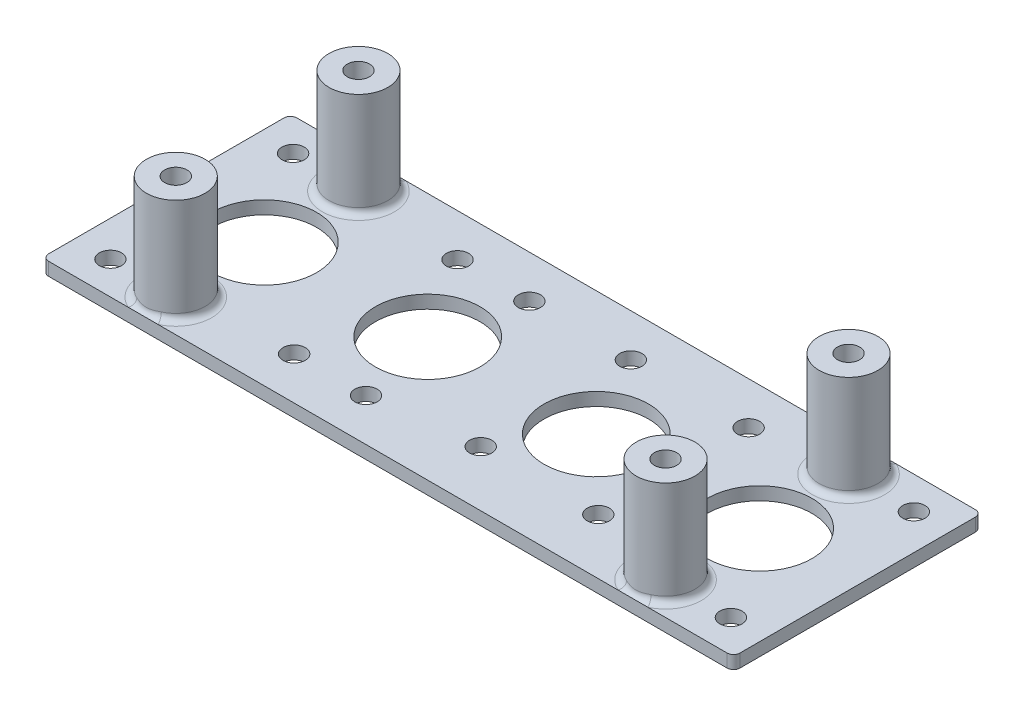
from build123d import *

# Parameters (mm, degrees)
SKETCH1_W           = 105.8
SKETCH1_H           = 37.999959088
SKETCH1_R           = 1.7
SKETCH1_R_2         = 8
BOSS_EXTRUDE3_DEPTH = 2
FILLET1_R           = 1
SKETCH4_R           = 4.5
SKETCH4_R_2         = 1.7
BOSS_EXTRUDE4_DEPTH = 16
FILLET2_R           = 1
CUT_EXTRUDE1_DEPTH  = 2


with BuildPart() as part:
    # Sketch1 → Boss-Extrude3 (new body)
    with BuildSketch(Plane(origin=(0, 0, 0), x_dir=(1, 0, 0), z_dir=(0, 1, 0))):
        with Locations((0, -2.0456e-05)):
            Rectangle(SKETCH1_W, SKETCH1_H)
        with Locations(Location((-47.5, 13.999959088, 0), (0, 0, 270))):
            Circle(SKETCH1_R, mode=Mode.SUBTRACT)
        with Locations(Location((-47.45213511, -14, 0), (0, 0, 270))):
            Circle(SKETCH1_R, mode=Mode.SUBTRACT)
        with Locations(Location((47.5, 13.999959088, 0), (0, 0, 270))):
            Circle(SKETCH1_R, mode=Mode.SUBTRACT)
        with Locations(Location((47.5, -14.000040912, 0), (0, 0, 270))):
            Circle(SKETCH1_R, mode=Mode.SUBTRACT)
        with Locations(Location((-20.838777713, 12.499959088, 0), (0, 0, 270))):
            Circle(SKETCH1_R, mode=Mode.SUBTRACT)
        with Locations(Location((-20.838777713, -12.500040912, 0), (0, 0, 270))):
            Circle(SKETCH1_R, mode=Mode.SUBTRACT)
        with Locations(Location((-9.838777713, 12.499959088, 0), (0, 0, 270))):
            Circle(SKETCH1_R, mode=Mode.SUBTRACT)
        with Locations(Location((-9.838777713, -12.500040912, 0), (0, 0, 270))):
            Circle(SKETCH1_R, mode=Mode.SUBTRACT)
        with Locations(Location((5.708304913, 12.482293054, 0), (0, 0, 270))):
            Circle(SKETCH1_R, mode=Mode.SUBTRACT)
        with Locations(Location((5.708304913, -10.500040912, 0), (0, 0, 270))):
            Circle(SKETCH1_R, mode=Mode.SUBTRACT)
        with Locations(Location((23.708296244, 12.499959088, 0), (0, 0, 270))):
            Circle(SKETCH1_R, mode=Mode.SUBTRACT)
        with Locations(Location((23.708296244, -10.500040912, 0), (0, 0, 270))):
            Circle(SKETCH1_R, mode=Mode.SUBTRACT)
        with Locations(Location((-37.5, 13.999959088, 0), (0, 0, 270))):
            Circle(SKETCH1_R, mode=Mode.SUBTRACT)
        with Locations(Location((-37.45213511, -14, 0), (0, 0, 270))):
            Circle(SKETCH1_R, mode=Mode.SUBTRACT)
        with Locations(Location((37.5, 13.999959088, 0), (0, 0, 270))):
            Circle(SKETCH1_R, mode=Mode.SUBTRACT)
        with Locations(Location((37.5, -14.000040912, 0), (0, 0, 270))):
            Circle(SKETCH1_R, mode=Mode.SUBTRACT)
        with Locations(Location((-37.9, 0, 0), (0, 0, 270))):
            Circle(SKETCH1_R_2, mode=Mode.SUBTRACT)
        with Locations(Location((-12.9, 0, 0), (0, 0, 270))):
            Circle(SKETCH1_R_2, mode=Mode.SUBTRACT)
        with Locations(Location((37.9, 0, 0), (0, 0, 270))):
            Circle(SKETCH1_R_2, mode=Mode.SUBTRACT)
        with Locations(Location((12.9, 0, 0), (0, 0, 270))):
            Circle(SKETCH1_R_2, mode=Mode.SUBTRACT)
    extrude(amount=BOSS_EXTRUDE3_DEPTH)

    # Fillet1
    fillet1_edges = [part.edges().sort_by_distance(p)[0] for p in [
        (-52.9, 1, -18.999959088),
        (52.9, 1, -18.999959088),
        (52.9, 1, 19),
        (-52.9, 1, 19),
    ]]
    fillet(fillet1_edges, radius=FILLET1_R)

    # Sketch4 → Boss-Extrude4 (add)
    # profile 1 of 4: a face of its own
    with BuildSketch(Plane(origin=(0, 2, 0), x_dir=(1, 0, 0), z_dir=(0, 1, 0))):
        with Locations(Location((-37.5, 13.999959088, 0), (0, 0, 270))):
            Circle(SKETCH4_R)
        with Locations(Location((-37.5, 13.999959088, 0), (0, 0, 270))):
            Circle(SKETCH4_R_2, mode=Mode.SUBTRACT)
    # profile 2 of 4: a face of its own
    with BuildSketch(Plane(origin=(0, 2, 0), x_dir=(1, 0, 0), z_dir=(0, 1, 0))):
        with Locations(Location((-37.45213511, -14, 0), (0, 0, 270))):
            Circle(SKETCH4_R)
        with Locations(Location((-37.45213511, -14, 0), (0, 0, 270))):
            Circle(SKETCH4_R_2, mode=Mode.SUBTRACT)
    # profile 3 of 4: a face of its own
    with BuildSketch(Plane(origin=(0, 2, 0), x_dir=(1, 0, 0), z_dir=(0, 1, 0))):
        with Locations(Location((37.5, 13.999959088, 0), (0, 0, 270))):
            Circle(SKETCH4_R)
        with Locations(Location((37.5, 13.999959088, 0), (0, 0, 270))):
            Circle(SKETCH4_R_2, mode=Mode.SUBTRACT)
    # profile 4 of 4: a face of its own
    with BuildSketch(Plane(origin=(0, 2, 0), x_dir=(1, 0, 0), z_dir=(0, 1, 0))):
        with Locations(Location((37.5, -14.000040912, 0), (0, 0, 270))):
            Circle(SKETCH4_R)
        with Locations(Location((37.5, -14.000040912, 0), (0, 0, 270))):
            Circle(SKETCH4_R_2, mode=Mode.SUBTRACT)
    extrude(amount=BOSS_EXTRUDE4_DEPTH)

    # Fillet2
    fillet2_edges = [part.edges().sort_by_distance(p)[0] for p in [
        (-37.5, 2, -18.499959088),
        (-37.45213511, 2, 9.5),
        (37.5, 2, -18.499959088),
        (37.5, 2, 9.500040912),
    ]]
    fillet(fillet2_edges, radius=FILLET2_R)

    # Sketch7 → Cut-Extrude1 (cut)
    with BuildSketch(Plane.XZ):
        Polygon((-39.475935598, 10.501776891), (-35.434485274, 10.498225811), (-33.410684786, 13.99644892), (-35.428334623, 17.498223109), (-39.469784947, 17.501774189), (-41.493585435, 14.00355108), align=None)
        Polygon((-39.553524155, -17.480817011), (-35.512250689, -17.518792135), (-33.458726534, -14.037934212), (-35.446475845, -10.519101166), (-39.487749311, -10.481126042), (-41.541273466, -13.961983965), align=None)
        Polygon((39.557104105, 10.521297455), (41.541232259, 14.042173596), (39.484128154, 17.520917053), (35.442895895, 17.478784368), (33.458767741, 13.957908227), (35.515871846, 10.479164771), align=None)
        Polygon((41.541451884, -13.999959088), (39.520725942, -10.499959088), (35.479274058, -10.499959088), (33.458548116, -13.999959088), (35.479274058, -17.499959088), (39.520725942, -17.499959088), align=None)
    extrude(amount=-CUT_EXTRUDE1_DEPTH, mode=Mode.SUBTRACT)


solid = part.part
